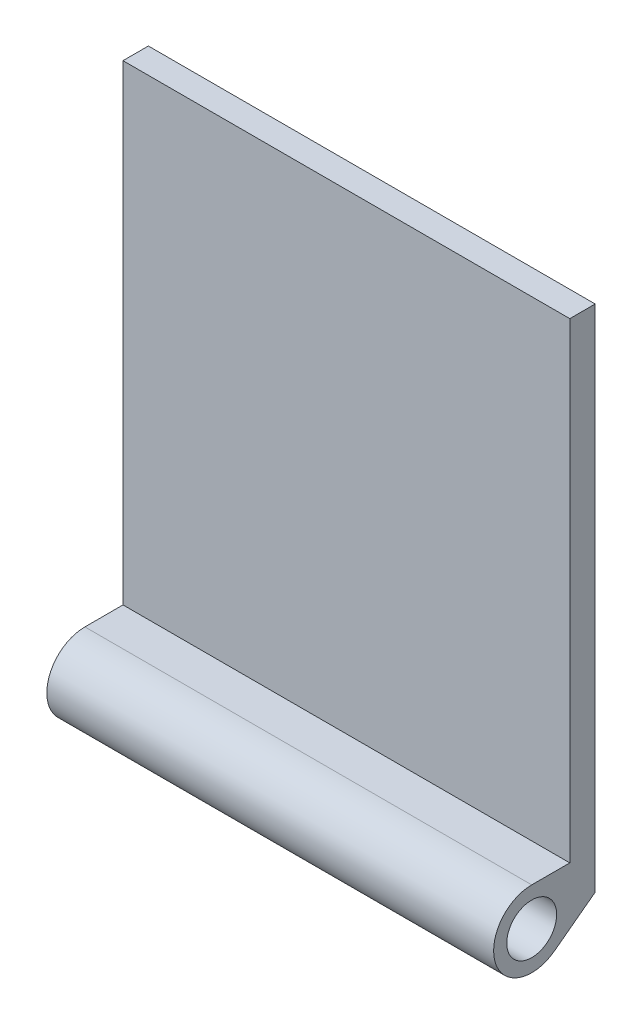
from build123d import *

# Parameters (mm, degrees)
CROQUIS1_W              = 26.4
CROQUIS1_H              = 30.1
SALIENTE_EXTRUIR1_DEPTH = 1.5
CROQUIS3_R              = 1.475
SALIENTE_EXTRUIR3_DEPTH = 26.4


with BuildPart() as part:
    # Croquis1 → Saliente-Extruir1 (new body)
    with BuildSketch(Plane.XY):
        with Locations((14.119367589, -6.959881423)):
            Rectangle(CROQUIS1_W, CROQUIS1_H)
    extrude(amount=SALIENTE_EXTRUIR1_DEPTH)

    # Croquis3 → Saliente-Extruir3 (add)
    with BuildSketch(Plane(origin=(27.319367589, 0, 0), x_dir=(0, 0, -1), z_dir=(1, 0, 0))):
        with BuildLine():
            Line((0, -22.009881423), (-2.400129029, -23.809709392))
            ThreePointArc((-2.400129029, -23.809709392), (-5.88456292, -22.721048598), (-3.75, -19.759612628))
            Line((-3.75, -19.759612628), (-1.5, -19.759612628))
            Line((-1.5, -19.759612628), (0, -22.009881423))
        make_face()
        with Locations((-3.75, -22.009612628)):
            Circle(CROQUIS3_R, mode=Mode.SUBTRACT)
    extrude(amount=-SALIENTE_EXTRUIR3_DEPTH)


solid = part.part
